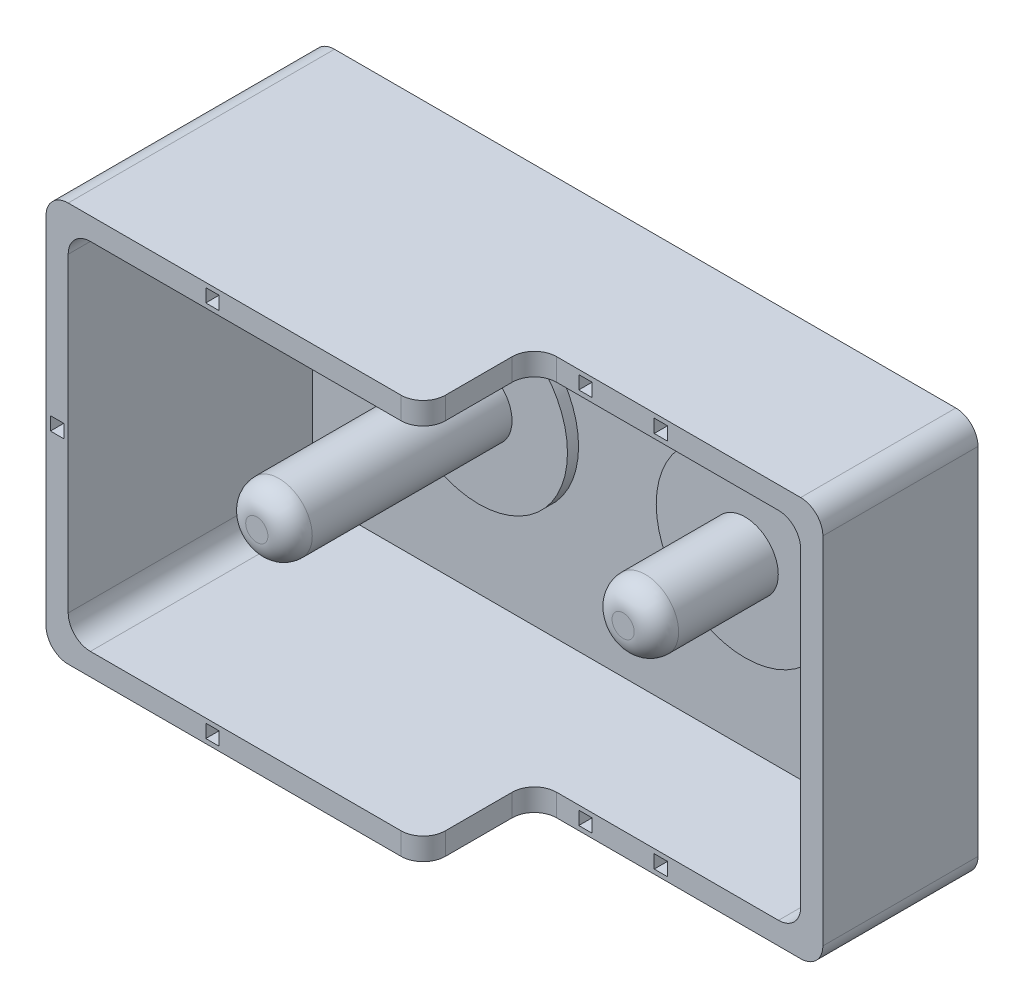
from build123d import *

# Parameters (mm, degrees)
SKETCH1_W           = 150
SKETCH1_H           = 90
BOSS_EXTRUDE1_DEPTH = 60
SHELL4_T            = -5
SKETCH2_R           = 20
BOSS_EXTRUDE2_DEPTH = 2.5
SKETCH3_R           = 7.5
BOSS_EXTRUDE3_DEPTH = 50
SKETCH4_W           = 65
SKETCH4_H           = 14.658499389
CUT_EXTRUDE1_DEPTH  = 185.932420089
SKETCH6_W           = 3
SKETCH6_H           = 3
CUT_EXTRUDE3_DEPTH  = 40
FILLET4_R           = 5
FILLET5_R           = 5
SKETCH10_W          = 3
SKETCH10_H          = 3
CUT_EXTRUDE4_DEPTH  = 40


with BuildPart() as part:
    # Sketch1 → Boss-Extrude1 (new body)
    with BuildSketch(Plane.XY):
        with Locations((75, -45)):
            Rectangle(SKETCH1_W, SKETCH1_H)
    extrude(amount=BOSS_EXTRUDE1_DEPTH)

    # Shell4
    shell4_openings = [part.faces().sort_by_distance(p)[0] for p in [
        (75, -45, 60),
    ]]
    offset(amount=SHELL4_T, openings=shell4_openings, kind=Kind.INTERSECTION)

    # Sketch2 → Boss-Extrude2 (add)
    with BuildSketch(Plane.XY.offset(5)):
        with Locations((45, -45)):
            Circle(SKETCH2_R)
        with Locations((105, -45)):
            Circle(SKETCH2_R)
    extrude(amount=BOSS_EXTRUDE2_DEPTH)

    # Sketch3 → Boss-Extrude3 (add)
    with BuildSketch(Plane.XY.offset(7.5)):
        with Locations((45, -45)):
            Circle(SKETCH3_R)
        with Locations((105, -45)):
            Circle(SKETCH3_R)
    extrude(amount=BOSS_EXTRUDE3_DEPTH)

    # Sketch4 → Cut-Extrude1 (cut, through all)
    with BuildSketch(Plane.XZ.offset(90)):
        Polygon((85, 60), (85, 49.954434269), (85, 34.954434269), (150, 34.954434269), (150, 60), align=None)
        with Locations((117.5, 67.329249695)):
            Rectangle(SKETCH4_W, SKETCH4_H)
    extrude(amount=-CUT_EXTRUDE1_DEPTH, mode=Mode.SUBTRACT)

    # Sketch6 → Cut-Extrude3 (cut)
    with BuildSketch(Plane.XY.offset(34.954434269)):
        with Locations((96.5, -2.5)):
            Rectangle(SKETCH6_W, SKETCH6_H)
        with Locations((113.5, -2.5)):
            Rectangle(SKETCH6_W, SKETCH6_H)
        with Locations((96.5, -87.5)):
            Rectangle(SKETCH6_W, SKETCH6_H)
        with Locations((113.5, -87.5)):
            Rectangle(SKETCH6_W, SKETCH6_H)
    extrude(amount=-CUT_EXTRUDE3_DEPTH, mode=Mode.SUBTRACT)

    # Fillet4
    fillet4_edges = [part.edges().sort_by_distance(p)[0] for p in [
        (5, -5, 32.5),
        (5, -85, 32.5),
        (145, -5, 19.977217134),
        (145, -85, 19.977217134),
        (150, 0, 17.477217134),
        (150, -90, 17.477217134),
        (85, -87.5, 60),
        (85, -87.5, 34.954434269),
        (85, -2.5, 60),
        (85, -2.5, 34.954434269),
        (0, 0, 30),
        (0, -90, 30),
    ]]
    fillet(fillet4_edges, radius=FILLET4_R)

    # Fillet5
    fillet5_edges = [part.edges().sort_by_distance(p)[0] for p in [
        (37.5, -45, 57.5),
        (97.5, -45, 34.954434269),
    ]]
    fillet(fillet5_edges, radius=FILLET5_R)

    # Sketch10 → Cut-Extrude4 (cut)
    with BuildSketch(Plane.XY.offset(60)):
        with Locations((2.5, -45)):
            Rectangle(SKETCH10_W, SKETCH10_H)
        with Locations((37.5, -87.5)):
            Rectangle(SKETCH10_W, SKETCH10_H)
        with Locations((37.5, -2.5)):
            Rectangle(SKETCH10_W, SKETCH10_H)
    extrude(amount=-CUT_EXTRUDE4_DEPTH, mode=Mode.SUBTRACT)


solid = part.part
